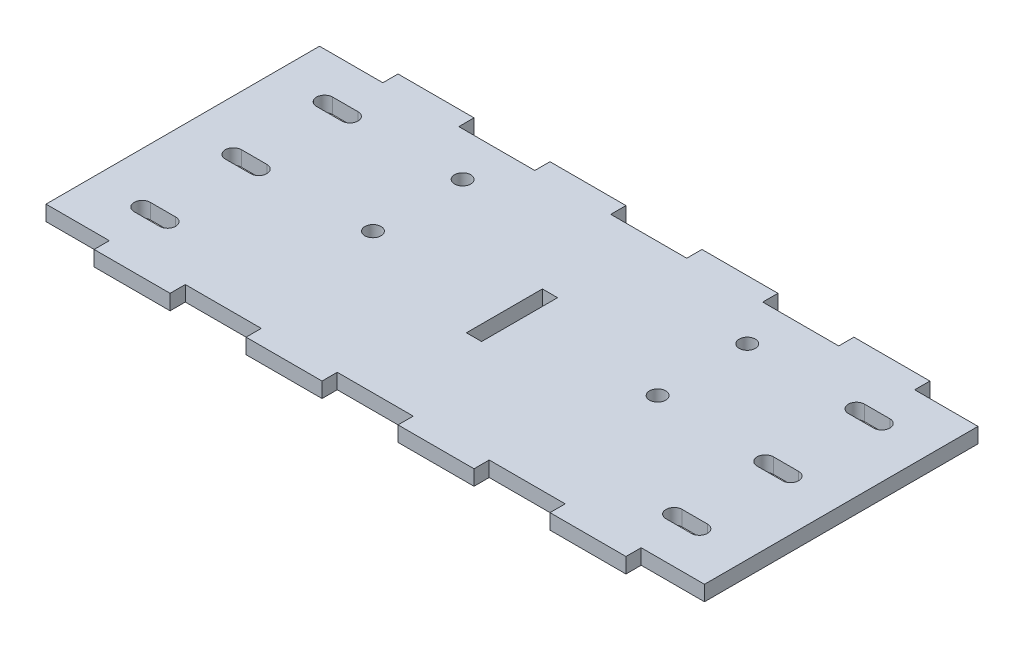
from build123d import *

# Parameters (mm, degrees)
BOSS_EXTRUDE1_DEPTH = 3
CUT_EXTRUDE1_DEPTH  = 72.651936471
SKETCH3_W           = 3
SKETCH3_H           = 15
CUT_EXTRUDE2_DEPTH  = 72.651936471
SKETCH4_R           = 1.6
CUT_EXTRUDE3_DEPTH  = 72.651936471


with BuildPart() as part:
    # Sketch1 → Boss-Extrude1 (new body)
    with BuildSketch(Plane(origin=(0, 0, 0), x_dir=(1, 0, 0), z_dir=(0, 1, 0))):
        Polygon((-65, 27), (-52.5, 27), (-52.5, 30), (-37.5, 30), (-37.5, 27), (-22.5, 27), (-22.5, 30), (-7.5, 30), (-7.5, 27), (7.5, 27), (7.5, 30), (22.5, 30), (22.5, 27), (37.5, 27), (37.5, 30), (52.5, 30), (52.5, 27), (65, 27), (65, -27), (52.5, -27), (52.5, -30), (37.5, -30), (37.5, -27), (22.5, -27), (22.5, -30), (7.5, -30), (7.5, -27), (-7.5, -27), (-7.5, -30), (-22.5, -30), (-22.5, -27), (-37.5, -27), (-37.5, -30), (-52.5, -30), (-52.5, -27), (-65, -27), align=None)
    extrude(amount=BOSS_EXTRUDE1_DEPTH)

    # Sketch2 → Cut-Extrude1 (cut, through all)
    with BuildSketch(Plane(origin=(0, 3, 0), x_dir=(1, 0, 0), z_dir=(0, 1, 0))):
        with BuildLine():
            Line((-55, 1.6), (-50, 1.6))
            ThreePointArc((-50, 1.6), (-48.4, 0), (-50, -1.6))
            Line((-50, -1.6), (-55, -1.6))
            ThreePointArc((-55, -1.6), (-56.6, 0), (-55, 1.6))
        make_face()
        with BuildLine():
            Line((55, 1.6), (50, 1.6))
            ThreePointArc((50, 1.6), (48.4, 0), (50, -1.6))
            Line((50, -1.6), (55, -1.6))
            ThreePointArc((55, -1.6), (56.6, 0), (55, 1.6))
        make_face()
        with BuildLine():
            Line((-55, 19.6), (-50, 19.6))
            ThreePointArc((-50, 19.6), (-48.4, 18), (-50, 16.4))
            Line((-50, 16.4), (-55, 16.4))
            ThreePointArc((-55, 16.4), (-56.6, 18), (-55, 19.6))
        make_face()
        with BuildLine():
            Line((-55, -16.4), (-50, -16.4))
            ThreePointArc((-50, -16.4), (-48.4, -18), (-50, -19.6))
            Line((-50, -19.6), (-55, -19.6))
            ThreePointArc((-55, -19.6), (-56.6, -18), (-55, -16.4))
        make_face()
        with BuildLine():
            Line((55, 19.6), (50, 19.6))
            ThreePointArc((50, 19.6), (48.4, 18), (50, 16.4))
            Line((50, 16.4), (55, 16.4))
            ThreePointArc((55, 16.4), (56.6, 18), (55, 19.6))
        make_face()
        with BuildLine():
            Line((55, -16.4), (50, -16.4))
            ThreePointArc((50, -16.4), (48.4, -18), (50, -19.6))
            Line((50, -19.6), (55, -19.6))
            ThreePointArc((55, -19.6), (56.6, -18), (55, -16.4))
        make_face()
    extrude(amount=-CUT_EXTRUDE1_DEPTH, mode=Mode.SUBTRACT)

    # Sketch3 → Cut-Extrude2 (cut, through all)
    with BuildSketch(Plane(origin=(0, 3, 0), x_dir=(1, 0, 0), z_dir=(0, 1, 0))):
        Rectangle(SKETCH3_W, SKETCH3_H)
    extrude(amount=-CUT_EXTRUDE2_DEPTH, mode=Mode.SUBTRACT)

    # Sketch4 → Cut-Extrude3 (cut, through all)
    with BuildSketch(Plane.XZ):
        with Locations(Location((-28.1, -0.65, 0), (0, 0, 270))):
            Circle(SKETCH4_R)
        with Locations(Location((-28.1, -18.35, 0), (0, 0, 270))):
            Circle(SKETCH4_R)
    cut_extrude3 = extrude(amount=-CUT_EXTRUDE3_DEPTH, mode=Mode.SUBTRACT)

    # Mirror1: Cut-Extrude3 across plane
    add(cut_extrude3.mirror(Plane(origin=(0, 0, 0), x_dir=(0, 0, 1), z_dir=(1, 0, 0))), mode=Mode.SUBTRACT)


solid = part.part
